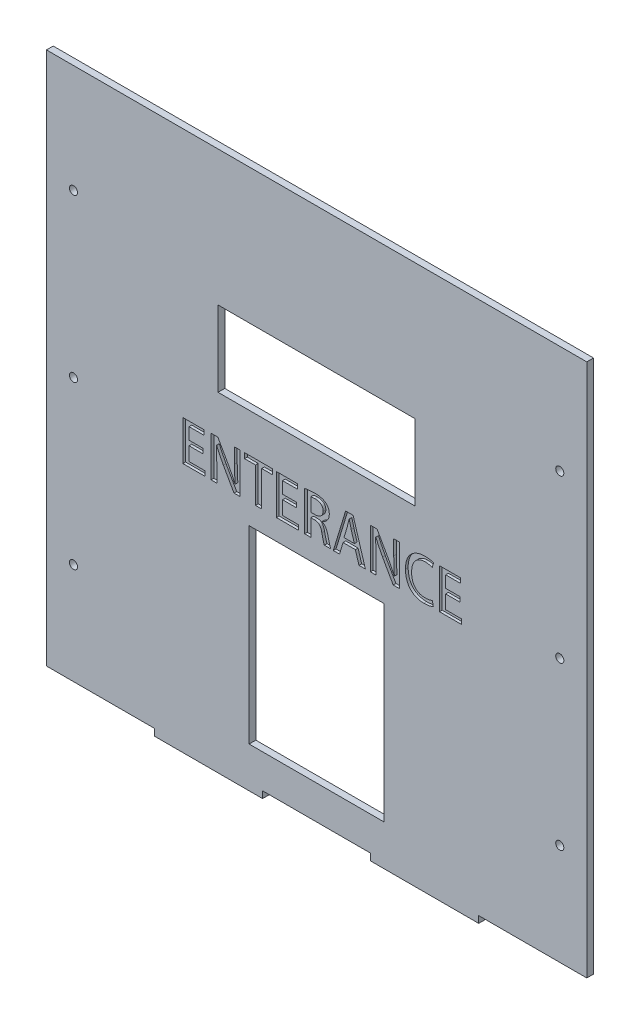
from build123d import *

# Parameters (mm, degrees)
SKETCH1_R           = 1.5
SKETCH1_W           = 50
SKETCH1_H           = 70
SKETCH1_W_2         = 73
SKETCH1_H_2         = 28
BOSS_EXTRUDE1_DEPTH = 2.5
CUT_EXTRUDE1_DEPTH  = 1


with BuildPart() as part:
    # Sketch1 → Boss-Extrude1 (new body)
    with BuildSketch(Plane.XY):
        Polygon((100, 100), (-100, 100), (-100, -97.5), (-60, -97.5), (-60, -100), (-20, -100), (-20, -97.5), (20, -97.5), (20, -100), (60, -100), (60, -97.5), (100, -97.5), align=None)
        with Locations((-90, -60)):
            Circle(SKETCH1_R, mode=Mode.SUBTRACT)
        with Locations((0, -50)):
            Rectangle(SKETCH1_W, SKETCH1_H, mode=Mode.SUBTRACT)
        with Locations((90, -60)):
            Circle(SKETCH1_R, mode=Mode.SUBTRACT)
        with Locations((-90, 0)):
            Circle(SKETCH1_R, mode=Mode.SUBTRACT)
        with Locations((0, 36)):
            Rectangle(SKETCH1_W_2, SKETCH1_H_2, mode=Mode.SUBTRACT)
        with Locations((-90, 60)):
            Circle(SKETCH1_R, mode=Mode.SUBTRACT)
        with Locations((90, 0)):
            Circle(SKETCH1_R, mode=Mode.SUBTRACT)
        with Locations((90, 60)):
            Circle(SKETCH1_R, mode=Mode.SUBTRACT)
    extrude(amount=BOSS_EXTRUDE1_DEPTH)

    # Sketch2 → Cut-Extrude1 (cut)
    # profile 1 of 9: a face of its own
    with BuildSketch(Plane.XY.offset(2.5)):
        Polygon((-41.347641185, -5.570371429), (-47.20608773, -5.570371429), (-47.20608773, -0.501892518), (-41.989929344, -0.501892518), (-41.989929344, 1.277707709), (-47.20608773, 1.277707709), (-47.20608773, 5.625335895), (-41.678516903, 5.625335895), (-41.678516903, 7.404938873), (-49.492538873, 7.404938873), (-49.492538873, -7.349971657), (-41.347641185, -7.349971657), align=None)
    # profile 2 of 9: a face of its own
    with BuildSketch(Plane.XY.offset(2.5)):
        with BuildLine():
            Line((-28.283758945, 7.568256615), (-30.389997408, 7.568256615))
            Line((-30.389997408, 7.568256615), (-30.389997408, 2.075655342))
            add(Edge.make_bspline(
                [(-30.389997408, 2.075655342), (-30.390930622, 1.784326179), (-30.392762918, 1.212323257), (-30.379520985, 0.369086902), (-30.36305815, -0.444709355), (-30.334070512, -1.489733663), (-30.273848852, -2.772687348), (-30.195415415, -3.791877994), (-30.156278587, -4.300435191)],
                knots=[0, 0, 0, 0, 0.821614023, 1.613177398, 2.378363483, 3.117216942, 4.56154481, 6, 6, 6, 6], degree=3))
            Line((-30.156278587, -4.300435191), (-30.212718792, -4.318655547))
            add(Edge.make_bspline(
                [(-30.212718792, -4.318655547), (-30.383227757, -3.910427773), (-30.731128996, -3.077492398), (-31.319884882, -1.834790145), (-31.950985125, -0.574944571), (-32.413303977, 0.253482256), (-32.645466247, 0.66949266)],
                knots=[0, 0, 0, 0, 0.955842181, 1.950270942, 2.970689279, 4, 4, 4, 4], degree=3))
            Line((-32.645466247, 0.66949266), (-36.561641032, 7.585151554))
            Line((-36.561641032, 7.585151554), (-39.040203359, 7.585151554))
            Line((-39.040203359, 7.585151554), (-39.040203359, -7.349971657))
            Line((-39.040203359, -7.349971657), (-36.933964897, -7.349971657))
            Line((-36.933964897, -7.349971657), (-36.933964897, -1.794008864))
            add(Edge.make_bspline(
                [(-36.933964897, -1.794008864), (-36.934740575, -1.475934949), (-36.936253308, -0.855624383), (-36.94118127, 0.050977401), (-36.95217126, 0.908898587), (-36.975130435, 1.974297369), (-37.010772748, 3.237259652), (-37.06516431, 4.229722116), (-37.091650993, 4.713014696)],
                knots=[0, 0, 0, 0, 0.879484195, 1.715177864, 2.506803862, 3.251809647, 4.661732754, 6, 6, 6, 6], degree=3))
            Line((-37.091650993, 4.713014696), (-37.012697952, 4.733905134))
            add(Edge.make_bspline(
                [(-37.012697952, 4.733905134), (-36.832100313, 4.304028829), (-36.466904667, 3.434754151), (-35.854338066, 2.150814358), (-35.204713046, 0.878160881), (-34.751490787, 0.040684441), (-34.526436108, -0.375177727)],
                knots=[0, 0, 0, 0, 0.984107413, 1.990013513, 3.00190943, 4, 4, 4, 4], degree=3))
            Line((-34.526436108, -0.375177727), (-30.585922602, -7.349971657))
            Line((-30.585922602, -7.349971657), (-28.283758945, -7.349971657))
            Line((-28.283758945, -7.349971657), (-28.283758945, 7.568256615))
        make_face()
    # profile 3 of 9: a face of its own
    with BuildSketch(Plane.XY.offset(2.5)):
        Polygon((-16.325499765, 7.568674589), (-26.65028454, 7.568674589), (-26.65028454, 5.641810111), (-22.640849363, 5.641810111), (-22.640849363, -7.320732743), (-20.354398219, -7.320732743), (-20.354398219, 5.641810111), (-16.325499765, 5.641810111), align=None)
    # profile 4 of 9: a face of its own
    with BuildSketch(Plane.XY.offset(2.5)):
        Polygon((-6.746806379, -5.570371429), (-12.605252924, -5.570371429), (-12.605252924, -0.501892518), (-7.389094539, -0.501892518), (-7.389094539, 1.277707709), (-12.605252924, 1.277707709), (-12.605252924, 5.625335895), (-7.077682098, 5.625335895), (-7.077682098, 7.404938873), (-14.891704068, 7.404938873), (-14.891704068, -7.349971657), (-6.746806379, -7.349971657), align=None)
    # profile 5 of 9: a face of its own
    with BuildSketch(Plane.XY.offset(2.5)):
        with BuildLine():
            add(Edge.make_bspline(
                [(1.999346546, -0.182885054), (2.186126682, -0.10461403), (2.556663228, 0.050660913), (3.064967432, 0.369467865), (3.520274737, 0.752378962), (3.856641498, 1.117185715), (4.093527475, 1.438196207), (4.248487841, 1.695729906), (4.382371583, 1.966351862), (4.487590049, 2.253268892), (4.577732777, 2.552484932), (4.635984826, 2.86807127), (4.681775289, 3.195890748), (4.688783165, 3.419444422), (4.692348655, 3.533184798)],
                knots=[0, 0, 0, 0, 1.487627968, 2.951173198, 4.391941956, 5.852896075, 6.588857426, 7.322905964, 8.060807463, 8.805779607, 9.568204031, 10.356173087, 11.163648317, 12, 12, 12, 12], degree=3))
            add(Edge.make_bspline(
                [(4.692348655, 3.533184798), (4.688892133, 3.678911564), (4.682127582, 3.964104699), (4.619571014, 4.379379054), (4.529234791, 4.773812461), (4.396026584, 5.143891763), (4.225787029, 5.49038487), (4.018900417, 5.814086363), (3.773225759, 6.113982015), (3.584896278, 6.292724733), (3.489992172, 6.382797821)],
                knots=[0, 0, 0, 0, 1.095121042, 2.143195875, 3.151541685, 4.133861277, 5.093451856, 6.048906306, 7.016793323, 8, 8, 8, 8], degree=3))
            add(Edge.make_bspline(
                [(3.489992172, 6.382797821), (3.369519458, 6.482017928), (3.125099334, 6.683319865), (2.703048749, 6.926178725), (2.239428437, 7.135649964), (1.727754597, 7.303935689), (1.169060736, 7.428451907), (0.564994034, 7.517998601), (-0.087088386, 7.568831286), (-0.53748387, 7.570310435), (-0.770348246, 7.571075188)],
                knots=[0, 0, 0, 0, 0.827221313, 1.678301493, 2.574754406, 3.524835391, 4.531659668, 5.609758117, 6.764192347, 8, 8, 8, 8], degree=3))
            add(Edge.make_bspline(
                [(-0.770348246, 7.571075188), (-1.104574782, 7.565341518), (-1.763315921, 7.554040788), (-2.576551534, 7.500969065), (-3.199708196, 7.434422961), (-3.637640093, 7.385752354), (-4.048753739, 7.326351909), (-4.313686073, 7.280673452), (-4.442181627, 7.258518819)],
                knots=[0, 0, 0, 0, 1.630788357, 3.214189375, 3.973790731, 4.688368382, 5.363841967, 6, 6, 6, 6], degree=3))
            Line((-4.442181627, 7.258518819), (-4.439368554, -7.331737552))
            Line((-4.439368554, -7.331737552), (-2.15291741, -7.331737552))
            Line((-2.15291741, -7.331737552), (-2.15291741, -1.025635623))
            Line((-2.15291741, -1.025635623), (-0.788227623, -1.025635623))
            add(Edge.make_bspline(
                [(-0.788227623, -1.025635623), (-0.693947174, -1.026835914), (-0.510893156, -1.029166386), (-0.244434692, -1.059309206), (0.006873795, -1.101992022), (0.241577566, -1.168941429), (0.457612919, -1.261228797), (0.658231861, -1.369418931), (0.840100808, -1.501816979), (1.009194947, -1.651888061), (1.161434532, -1.829229404), (1.302488852, -2.030288496), (1.431946085, -2.25676012), (1.549954209, -2.509669375), (1.659428185, -2.787898743), (1.757457039, -3.092755473), (1.844337534, -3.422990382), (1.893428626, -3.652578087), (1.918762857, -3.77106044)],
                knots=[0, 0, 0, 0, 1.05460192, 2.04760499, 2.997500883, 3.905099692, 4.771330184, 5.622266628, 6.450198754, 7.283312565, 8.146991563, 9.059198733, 10.028584943, 11.062366604, 12.180106072, 13.372689096, 14.644134814, 16, 16, 16, 16], degree=3))
            add(Edge.make_bspline(
                [(1.918762857, -3.77106044), (1.964007878, -3.991794179), (2.050773366, -4.415090933), (2.187125101, -5.020066703), (2.314447045, -5.569047598), (2.441525221, -6.056639973), (2.557554134, -6.478570247), (2.664648594, -6.829962798), (2.759048116, -7.108606202), (2.829243542, -7.265860246), (2.859247788, -7.333076718)],
                knots=[0, 0, 0, 0, 1.465707569, 2.810758609, 4.034056387, 5.131408685, 6.088374617, 6.88023951, 7.521370969, 8, 8, 8, 8], degree=3))
            Line((2.859247788, -7.333076718), (5.220670222, -7.331737552))
            add(Edge.make_bspline(
                [(5.220670222, -7.331737552), (5.181200556, -7.246378061), (5.091486544, -7.052357107), (4.975538375, -6.711996273), (4.845571787, -6.296465827), (4.714313654, -5.805889691), (4.570830508, -5.252302077), (4.424203575, -4.641073639), (4.261549982, -3.980321197), (4.155797039, -3.521535788), (4.101025795, -3.283923036)],
                knots=[0, 0, 0, 0, 0.536382744, 1.219190635, 2.049369578, 3.02138797, 4.116602825, 5.313141612, 6.608430422, 8, 8, 8, 8], degree=3))
            add(Edge.make_bspline(
                [(4.101025795, -3.283923036), (4.056433957, -3.094351607), (3.970020532, -2.726985799), (3.791311201, -2.20955425), (3.586662609, -1.740888819), (3.350816604, -1.322827343), (3.076966066, -0.956394541), (2.758537921, -0.649689732), (2.399115916, -0.397404501), (2.132302923, -0.281590465), (1.997605905, -0.223123277)],
                knots=[0, 0, 0, 0, 1.204752405, 2.334660038, 3.382887791, 4.36651254, 5.299561436, 6.203487543, 7.093054398, 8, 8, 8, 8], degree=3))
            Line((1.997605905, -0.223123277), (1.999346546, -0.182885054))
        make_face()
        with BuildLine():
            Line((-2.15291741, 0.720174727), (-2.15291741, 5.687143763))
            add(Edge.make_bspline(
                [(-2.15291741, 5.687143763), (-2.113540234, 5.695845525), (-2.028502908, 5.714637492), (-1.888792806, 5.74059336), (-1.726144784, 5.762004903), (-1.54036169, 5.782441391), (-1.331725745, 5.795143424), (-1.0998824, 5.806441317), (-0.845503965, 5.815496402), (-0.668048591, 5.816366377), (-0.576056449, 5.816817369)],
                knots=[0, 0, 0, 0, 0.610479577, 1.318366527, 2.150290088, 3.093342812, 4.147205042, 5.313727128, 6.6074471, 8, 8, 8, 8], degree=3))
            add(Edge.make_bspline(
                [(-0.576056449, 5.816817369), (-0.473695903, 5.816252212), (-0.273398211, 5.81514632), (0.020822898, 5.791311307), (0.302971336, 5.754640139), (0.571495854, 5.690578066), (0.828445951, 5.61200974), (1.074175547, 5.517148639), (1.306179933, 5.401245473), (1.522990305, 5.265646234), (1.726496426, 5.112675768), (1.900588165, 4.927216998), (2.051764033, 4.719545635), (2.177650332, 4.486176303), (2.270200252, 4.22507421), (2.345906235, 3.941182921), (2.38847401, 3.631023215), (2.399972674, 3.415965742), (2.405900261, 3.305103123)],
                knots=[0, 0, 0, 0, 1.106370457, 2.164930326, 3.189675522, 4.179295379, 5.145535089, 6.093481301, 7.023881589, 7.944712809, 8.856157011, 9.767770694, 10.683273796, 11.627682375, 12.623061466, 13.671650375, 14.799730448, 16, 16, 16, 16], degree=3))
            add(Edge.make_bspline(
                [(2.405900261, 3.305103123), (2.401959062, 3.209233402), (2.394275731, 3.022336272), (2.354616212, 2.749580663), (2.289967276, 2.491820827), (2.199564835, 2.2480445), (2.083819584, 2.019748122), (1.944420105, 1.806085738), (1.780666613, 1.608007696), (1.590636616, 1.427892844), (1.379400413, 1.264543191), (1.148330993, 1.121004767), (0.898527373, 0.998752223), (0.629052291, 0.900934527), (0.340814022, 0.822267941), (0.033129503, 0.763142887), (-0.293597556, 0.726268643), (-0.51776572, 0.720374874), (-0.632372912, 0.717361653)],
                knots=[0, 0, 0, 0, 1.025018817, 1.998264639, 2.939871345, 3.860400683, 4.771147986, 5.669881975, 6.581843976, 7.511348994, 8.462473297, 9.431210568, 10.413769959, 11.42941867, 12.490522342, 13.604104313, 14.775085301, 16, 16, 16, 16], degree=3))
            Line((-0.632372912, 0.717361653), (-2.15291741, 0.720174727))
        make_face(mode=Mode.SUBTRACT)
    # profile 6 of 9: a face of its own
    with BuildSketch(Plane.XY.offset(2.5)):
        Polygon((13.494031593, 7.578406228), (10.730636655, 7.578406228), (6.176284703, -7.387212568), (8.492675966, -7.387212568), (9.777070796, -3.007975117), (14.330834285, -3.007975117), (15.673610699, -7.387212568), (18.047795082, -7.387212568), align=None)
        with BuildLine():
            Line((10.127360295, -1.262162018), (11.314452487, 2.685883265))
            add(Edge.make_bspline(
                [(11.314452487, 2.685883265), (11.378013253, 2.92479933), (11.508013582, 3.413452453), (11.678075502, 4.157020117), (11.848139576, 4.899614482), (11.959158357, 5.390663172), (12.013488832, 5.630973041)],
                knots=[0, 0, 0, 0, 0.979960343, 2.004305079, 3.023344945, 4, 4, 4, 4], degree=3))
            Line((12.013488832, 5.630973041), (12.053952541, 5.632078472))
            add(Edge.make_bspline(
                [(12.053952541, 5.632078472), (12.108468169, 5.393183117), (12.219912875, 4.904816319), (12.398894059, 4.165727197), (12.588444264, 3.41546437), (12.723348243, 2.915405926), (12.79065602, 2.66591127)],
                knots=[0, 0, 0, 0, 0.962008238, 1.966605348, 2.985476384, 4, 4, 4, 4], degree=3))
            Line((12.79065602, 2.66591127), (13.961084258, -1.262162018))
            Line((13.961084258, -1.262162018), (10.127360295, -1.262162018))
        make_face(mode=Mode.SUBTRACT)
    # profile 7 of 9: a face of its own
    with BuildSketch(Plane.XY.offset(2.5)):
        with BuildLine():
            Line((30.645787832, 7.568256615), (28.53954937, 7.568256615))
            Line((28.53954937, 7.568256615), (28.53954937, 2.075655342))
            add(Edge.make_bspline(
                [(28.53954937, 2.075655342), (28.538616156, 1.784326179), (28.53678386, 1.212323257), (28.550025793, 0.369086902), (28.566488628, -0.444709355), (28.595476266, -1.489733663), (28.655697926, -2.772687348), (28.734131363, -3.791877994), (28.773268191, -4.300435191)],
                knots=[0, 0, 0, 0, 0.821614023, 1.613177398, 2.378363483, 3.117216942, 4.56154481, 6, 6, 6, 6], degree=3))
            Line((28.773268191, -4.300435191), (28.716827986, -4.318655547))
            add(Edge.make_bspline(
                [(28.716827986, -4.318655547), (28.546319021, -3.910427773), (28.198417781, -3.077492398), (27.609661896, -1.834790145), (26.978561653, -0.574944571), (26.516242801, 0.253482256), (26.284080531, 0.66949266)],
                knots=[0, 0, 0, 0, 0.955842181, 1.950270942, 2.970689279, 4, 4, 4, 4], degree=3))
            Line((26.284080531, 0.66949266), (22.367905746, 7.585151554))
            Line((22.367905746, 7.585151554), (19.889343419, 7.585151554))
            Line((19.889343419, 7.585151554), (19.889343419, -7.349971657))
            Line((19.889343419, -7.349971657), (21.995581881, -7.349971657))
            Line((21.995581881, -7.349971657), (21.995581881, -1.794008864))
            add(Edge.make_bspline(
                [(21.995581881, -1.794008864), (21.994806203, -1.475934949), (21.99329347, -0.855624383), (21.988365508, 0.050977401), (21.977375517, 0.908898587), (21.954416343, 1.974297369), (21.91877403, 3.237259652), (21.864382468, 4.229722116), (21.837895785, 4.713014696)],
                knots=[0, 0, 0, 0, 0.879484195, 1.715177864, 2.506803862, 3.251809647, 4.661732754, 6, 6, 6, 6], degree=3))
            Line((21.837895785, 4.713014696), (21.916848826, 4.733905134))
            add(Edge.make_bspline(
                [(21.916848826, 4.733905134), (22.097446465, 4.304028829), (22.462642111, 3.434754151), (23.075208712, 2.150814358), (23.724833731, 0.878160881), (24.178055991, 0.040684441), (24.40311067, -0.375177727)],
                knots=[0, 0, 0, 0, 0.984107413, 1.990013513, 3.00190943, 4, 4, 4, 4], degree=3))
            Line((24.40311067, -0.375177727), (28.343624176, -7.349971657))
            Line((28.343624176, -7.349971657), (30.645787832, -7.349971657))
            Line((30.645787832, -7.349971657), (30.645787832, 7.568256615))
        make_face()
    # profile 8 of 9: a face of its own
    with BuildSketch(Plane.XY.offset(2.5)):
        with BuildLine():
            add(Edge.make_bspline(
                [(42.819638972, -5.059456269), (42.732531219, -5.098727845), (42.55282631, -5.179745833), (42.262862477, -5.279707886), (41.948198382, -5.370066711), (41.489353128, -5.47039772), (40.881997218, -5.563649715), (40.385193173, -5.579299806), (40.132298758, -5.587266368)],
                knots=[0, 0, 0, 0, 0.623279357, 1.285836859, 1.999327964, 2.758722695, 4.350051821, 6, 6, 6, 6], degree=3))
            add(Edge.make_bspline(
                [(40.132298758, -5.587266368), (39.943420953, -5.582175073), (39.574643278, -5.572234488), (39.036919943, -5.50129465), (38.531238824, -5.383610774), (38.057269264, -5.21967964), (37.6149943, -5.010572692), (37.204264734, -4.755335058), (36.823570349, -4.455858416), (36.480418648, -4.106530052), (36.16916991, -3.718457298), (35.90062799, -3.285793385), (35.672149904, -2.813992418), (35.48671749, -2.300182738), (35.341098842, -1.746855606), (35.235657011, -1.153588888), (35.166161205, -0.520398719), (35.156224515, -0.084399835), (35.151107614, 0.140117909)],
                knots=[0, 0, 0, 0, 1.05357022, 2.05706105, 3.019831997, 3.945549259, 4.849673394, 5.743319306, 6.637992512, 7.545159443, 8.469260999, 9.40786221, 10.379774602, 11.388606811, 12.450446757, 13.567948197, 14.747614263, 16, 16, 16, 16], degree=3))
            add(Edge.make_bspline(
                [(35.151107614, 0.140117909), (35.158130999, 0.375913806), (35.171763843, 0.833608863), (35.245885978, 1.496112362), (35.359014096, 2.114601154), (35.520583495, 2.685556587), (35.716230704, 3.21548969), (35.958418688, 3.698414045), (36.244330431, 4.136269158), (36.572643721, 4.525551448), (36.933041174, 4.868211444), (37.319066929, 5.167838135), (37.732297076, 5.419008905), (38.171208285, 5.625737092), (38.635738801, 5.786511659), (39.125162652, 5.902196695), (39.640405623, 5.970501555), (39.992239477, 5.978745471), (40.171720282, 5.982950934)],
                knots=[0, 0, 0, 0, 1.300058967, 2.523498372, 3.671327638, 4.762385131, 5.790754738, 6.781204902, 7.734179646, 8.667035103, 9.582038544, 10.471113154, 11.35590086, 12.242457161, 13.14087904, 14.060872889, 15.010794189, 16, 16, 16, 16], degree=3))
            add(Edge.make_bspline(
                [(40.171720282, 5.982950934), (40.306946132, 5.980718232), (40.570252946, 5.976370796), (40.953794125, 5.944735185), (41.315189298, 5.895545802), (41.65265412, 5.823112627), (41.968868215, 5.742955613), (42.26010953, 5.648762606), (42.530769216, 5.552684755), (42.698045103, 5.474567474), (42.779172514, 5.436681244)],
                knots=[0, 0, 0, 0, 1.208363836, 2.352881735, 3.437133088, 4.465326887, 5.435785295, 6.351019915, 7.200258411, 8, 8, 8, 8], degree=3))
            Line((42.779172514, 5.436681244), (43.267294356, 7.215000052))
            add(Edge.make_bspline(
                [(43.267294356, 7.215000052), (43.206366763, 7.243624091), (43.066936545, 7.309128992), (42.82114626, 7.393631368), (42.514711801, 7.478641123), (42.151212269, 7.57389804), (41.723862192, 7.656100716), (41.234374631, 7.711371957), (40.683908918, 7.751996896), (40.296640067, 7.758912496), (40.092877234, 7.762551162)],
                knots=[0, 0, 0, 0, 0.497728815, 1.139031319, 1.919228026, 2.850533018, 3.918187005, 5.13515125, 6.492650013, 8, 8, 8, 8], degree=3))
            add(Edge.make_bspline(
                [(40.092877234, 7.762551162), (39.835405803, 7.756877516), (39.330925124, 7.745760768), (38.591992638, 7.650377228), (37.889636918, 7.496707486), (37.222421039, 7.281843995), (36.591552049, 7.005490247), (35.997801235, 6.665357079), (35.439565395, 6.26614208), (34.920989135, 5.807048683), (34.448289214, 5.288441874), (34.035049333, 4.707183132), (33.685358292, 4.066714323), (33.397814335, 3.368447853), (33.170965381, 2.613604272), (33.002649936, 1.80159352), (32.895435688, 0.931255581), (32.873261534, 0.330962323), (32.861843397, 0.021853336)],
                knots=[0, 0, 0, 0, 1.03258902, 2.023219463, 2.983439502, 3.913466857, 4.830690834, 5.741453413, 6.65369381, 7.579319873, 8.515001589, 9.462699019, 10.433390624, 11.436184352, 12.486830696, 13.590904696, 14.759484638, 16, 16, 16, 16], degree=3))
            add(Edge.make_bspline(
                [(32.861843397, 0.021853336), (32.869348242, -0.270353586), (32.883940852, -0.838528144), (32.983103381, -1.663718184), (33.12960011, -2.438350502), (33.334062503, -3.162021884), (33.597405715, -3.832909716), (33.912161794, -4.455278879), (34.289598728, -5.023076253), (34.717560665, -5.541129765), (35.197948523, -5.999303833), (35.718115369, -6.403274901), (36.28196046, -6.742218417), (36.886709432, -7.019591456), (37.532494036, -7.236475047), (38.219906041, -7.393747005), (38.948840255, -7.490218279), (39.448696374, -7.505483603), (39.70429364, -7.513289399)],
                knots=[0, 0, 0, 0, 1.218475598, 2.369234888, 3.461691683, 4.503752951, 5.500362793, 6.463244622, 7.406714516, 8.337948286, 9.259888006, 10.169706265, 11.079364509, 11.997173012, 12.939204436, 13.91536257, 14.934038004, 16, 16, 16, 16], degree=3))
            add(Edge.make_bspline(
                [(39.70429364, -7.513289399), (39.901489202, -7.510744702), (40.28221423, -7.505831661), (40.833499549, -7.463822032), (41.345127292, -7.407563175), (41.815016059, -7.326117788), (42.236965499, -7.227072741), (42.609897345, -7.12472986), (42.929902539, -7.014675733), (43.119551249, -6.926227821), (43.207177632, -6.885360838)],
                knots=[0, 0, 0, 0, 1.319898282, 2.548324642, 3.699499855, 4.764539851, 5.738494737, 6.599877469, 7.353079316, 8, 8, 8, 8], degree=3))
            Line((43.207177632, -6.885360838), (42.819638972, -5.059456269))
        make_face()
    # profile 9 of 9: a face of its own
    with BuildSketch(Plane.XY.offset(2.5)):
        Polygon((53.624441849, -5.570371429), (47.765995304, -5.570371429), (47.765995304, -0.501892518), (52.982153689, -0.501892518), (52.982153689, 1.277707709), (47.765995304, 1.277707709), (47.765995304, 5.625335895), (53.29356613, 5.625335895), (53.29356613, 7.404938873), (45.47954416, 7.404938873), (45.47954416, -7.349971657), (53.624441849, -7.349971657), align=None)
    extrude(amount=-CUT_EXTRUDE1_DEPTH, mode=Mode.SUBTRACT)


solid = part.part
